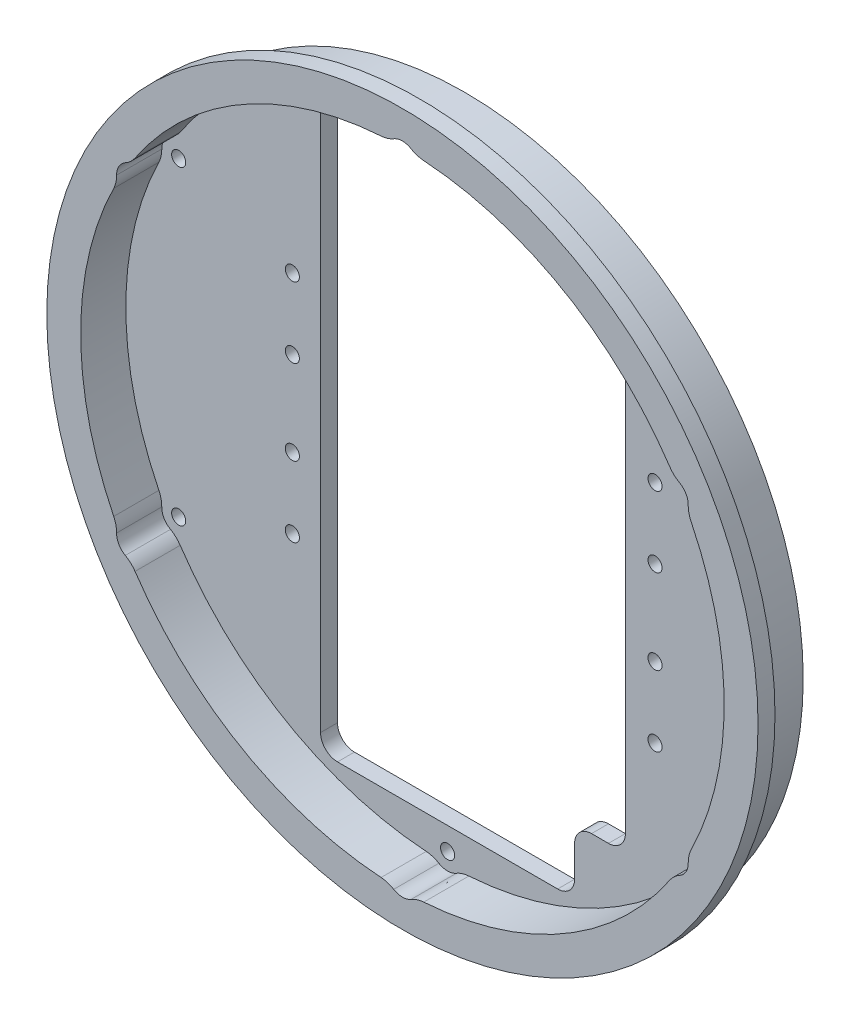
from build123d import *

# Parameters (mm, degrees)
SKETCH_1_R          = 60
EXTRUDE_1_DEPTH     = 3
SKETCH_2_R          = 60
SKETCH_2_R_2        = 57
EXTRUDE_2_DEPTH     = 8
EXTRUDE_START       = -3
SKETCH_3_R          = 63
SKETCH_3_R_2        = 60
EXTRUDE_3_DEPTH     = 3
CUT_EXTRUDE_1_REACH = 91.454
SKETCH_4_W          = 45
SKETCH_4_H          = 102
CUT_EXTRUDE_2_REACH = 91.454
SKETCH_5_W          = 9
SKETCH_5_H          = 79
FILLET_3_R          = 3
CUT_EXTRUDE_3_REACH = 91.454
SKETCH_6_R          = 1.25
CUT_EXTRUDE_4_REACH = 91.772
SKETCH_7_R          = 1.25
SKETCH_8_R          = 3
CUT_EXTRUDE_5_DEPTH = 8
FILLET_4_R          = 5


with BuildPart() as part:
    # 草图1 → 凸台-拉伸1 (new body)
    with BuildSketch(Plane.XY):
        Circle(SKETCH_1_R)
    extrude(amount=EXTRUDE_1_DEPTH)

    # 草图2 → 凸台-拉伸2 (add)
    with BuildSketch(Plane.XY.offset(3)):
        Circle(SKETCH_2_R)
        Circle(SKETCH_2_R_2, mode=Mode.SUBTRACT)
    extrude(amount=EXTRUDE_2_DEPTH)

    # 草图3 → 凸台-拉伸3 (add)
    with BuildSketch(Plane.XY.offset(11).offset(EXTRUDE_START)):
        Circle(SKETCH_3_R)
        Circle(SKETCH_3_R_2, mode=Mode.SUBTRACT)
    extrude(amount=EXTRUDE_3_DEPTH)

    # 草图4 → 切除-拉伸1 (cut, up to next)
    with BuildSketch(Plane.XY.offset(3), mode=Mode.PRIVATE) as cut_extrude_1_sk1:
        Rectangle(SKETCH_4_W, SKETCH_4_H)
    cut_extrude_1_tool1 = extrude(cut_extrude_1_sk1.sketch, amount=-CUT_EXTRUDE_1_REACH, mode=Mode.PRIVATE) & part.part
    add(cut_extrude_1_tool1.solids().sort_by_distance((0, 0, 3))[0], mode=Mode.SUBTRACT)

    # 草图5 → 切除-拉伸2 (cut, up to next)
    with BuildSketch(Plane.XY.offset(3), mode=Mode.PRIVATE) as cut_extrude_2_sk1:
        with Locations((27, 0)):
            Rectangle(SKETCH_5_W, SKETCH_5_H)
    cut_extrude_2_tool1 = extrude(cut_extrude_2_sk1.sketch, amount=-CUT_EXTRUDE_2_REACH, mode=Mode.PRIVATE) & part.part
    add(cut_extrude_2_tool1.solids().sort_by_distance((27, 0, 3))[0], mode=Mode.SUBTRACT)

    # 圆角3
    fillet_3_edges = [part.edges().sort_by_distance(p)[0] for p in [
        (22.5, 51, 1.5),
        (22.5, -51, 1.5),
        (-22.5, -51, 1.5),
        (-22.5, 51, 1.5),
        (22.5, -39.5, 1.5),
        (22.5, 39.5, 1.5),
        (31.5, 39.5, 1.5),
        (31.5, -39.5, 1.5),
    ]]
    fillet(fillet_3_edges, radius=FILLET_3_R)

    # 草图6 → 切除-拉伸3 (cut, up to next)
    with BuildSketch(Plane.XY.offset(3), mode=Mode.PRIVATE) as cut_extrude_3_sk1:
        with Locations((-27.5, 7.5)):
            Circle(SKETCH_6_R)
    cut_extrude_3_tool1 = extrude(cut_extrude_3_sk1.sketch, amount=-CUT_EXTRUDE_3_REACH, mode=Mode.PRIVATE) & part.part
    # 草图6 → 切除-拉伸3 (cut, up to next)
    with BuildSketch(Plane.XY.offset(3), mode=Mode.PRIVATE) as cut_extrude_3_sk2:
        with Locations((-27.5, 20)):
            Circle(SKETCH_6_R)
    cut_extrude_3_tool2 = extrude(cut_extrude_3_sk2.sketch, amount=-CUT_EXTRUDE_3_REACH, mode=Mode.PRIVATE) & part.part
    # 草图6 → 切除-拉伸3 (cut, up to next)
    with BuildSketch(Plane.XY.offset(3), mode=Mode.PRIVATE) as cut_extrude_3_sk3:
        with Locations((36.75, 7.5)):
            Circle(SKETCH_6_R)
    cut_extrude_3_tool3 = extrude(cut_extrude_3_sk3.sketch, amount=-CUT_EXTRUDE_3_REACH, mode=Mode.PRIVATE) & part.part
    # 草图6 → 切除-拉伸3 (cut, up to next)
    with BuildSketch(Plane.XY.offset(3), mode=Mode.PRIVATE) as cut_extrude_3_sk4:
        with Locations((36.75, 20)):
            Circle(SKETCH_6_R)
    cut_extrude_3_tool4 = extrude(cut_extrude_3_sk4.sketch, amount=-CUT_EXTRUDE_3_REACH, mode=Mode.PRIVATE) & part.part
    # 草图6 → 切除-拉伸3 (cut, up to next)
    with BuildSketch(Plane.XY.offset(3), mode=Mode.PRIVATE) as cut_extrude_3_sk5:
        with Locations((36.75, -7.5)):
            Circle(SKETCH_6_R)
    cut_extrude_3_tool5 = extrude(cut_extrude_3_sk5.sketch, amount=-CUT_EXTRUDE_3_REACH, mode=Mode.PRIVATE) & part.part
    # 草图6 → 切除-拉伸3 (cut, up to next)
    with BuildSketch(Plane.XY.offset(3), mode=Mode.PRIVATE) as cut_extrude_3_sk6:
        with Locations((-27.5, -7.5)):
            Circle(SKETCH_6_R)
    cut_extrude_3_tool6 = extrude(cut_extrude_3_sk6.sketch, amount=-CUT_EXTRUDE_3_REACH, mode=Mode.PRIVATE) & part.part
    # 草图6 → 切除-拉伸3 (cut, up to next)
    with BuildSketch(Plane.XY.offset(3), mode=Mode.PRIVATE) as cut_extrude_3_sk7:
        with Locations((-27.5, -20)):
            Circle(SKETCH_6_R)
    cut_extrude_3_tool7 = extrude(cut_extrude_3_sk7.sketch, amount=-CUT_EXTRUDE_3_REACH, mode=Mode.PRIVATE) & part.part
    # 草图6 → 切除-拉伸3 (cut, up to next)
    with BuildSketch(Plane.XY.offset(3), mode=Mode.PRIVATE) as cut_extrude_3_sk8:
        with Locations((36.75, -20)):
            Circle(SKETCH_6_R)
    cut_extrude_3_tool8 = extrude(cut_extrude_3_sk8.sketch, amount=-CUT_EXTRUDE_3_REACH, mode=Mode.PRIVATE) & part.part
    add(cut_extrude_3_tool1.solids().sort_by_distance((-27.5, 7.5, 3))[0], mode=Mode.SUBTRACT)
    add(cut_extrude_3_tool2.solids().sort_by_distance((-27.5, 20, 3))[0], mode=Mode.SUBTRACT)
    add(cut_extrude_3_tool3.solids().sort_by_distance((36.75, 7.5, 3))[0], mode=Mode.SUBTRACT)
    add(cut_extrude_3_tool4.solids().sort_by_distance((36.75, 20, 3))[0], mode=Mode.SUBTRACT)
    add(cut_extrude_3_tool5.solids().sort_by_distance((36.75, -7.5, 3))[0], mode=Mode.SUBTRACT)
    add(cut_extrude_3_tool6.solids().sort_by_distance((-27.5, -7.5, 3))[0], mode=Mode.SUBTRACT)
    add(cut_extrude_3_tool7.solids().sort_by_distance((-27.5, -20, 3))[0], mode=Mode.SUBTRACT)
    add(cut_extrude_3_tool8.solids().sort_by_distance((36.75, -20, 3))[0], mode=Mode.SUBTRACT)

    # 草图7 → 切除-拉伸4 (cut, up to next)
    with BuildSketch(Plane(origin=(0, 0, 0), x_dir=(-1, 0, 0), z_dir=(0, 0, -1)), mode=Mode.PRIVATE) as cut_extrude_4_sk1:
        with Locations((0, 55)):
            Circle(SKETCH_7_R)
    cut_extrude_4_tool1 = extrude(cut_extrude_4_sk1.sketch, amount=-CUT_EXTRUDE_4_REACH, mode=Mode.PRIVATE) & part.part
    # 草图7 → 切除-拉伸4 (cut, up to next)
    with BuildSketch(Plane(origin=(0, 0, 0), x_dir=(-1, 0, 0), z_dir=(0, 0, -1)), mode=Mode.PRIVATE) as cut_extrude_4_sk2:
        with Locations((47.631397208, 27.5)):
            Circle(SKETCH_7_R)
    cut_extrude_4_tool2 = extrude(cut_extrude_4_sk2.sketch, amount=-CUT_EXTRUDE_4_REACH, mode=Mode.PRIVATE) & part.part
    # 草图7 → 切除-拉伸4 (cut, up to next)
    with BuildSketch(Plane(origin=(0, 0, 0), x_dir=(-1, 0, 0), z_dir=(0, 0, -1)), mode=Mode.PRIVATE) as cut_extrude_4_sk3:
        with Locations((47.631397208, -27.5)):
            Circle(SKETCH_7_R)
    cut_extrude_4_tool3 = extrude(cut_extrude_4_sk3.sketch, amount=-CUT_EXTRUDE_4_REACH, mode=Mode.PRIVATE) & part.part
    # 草图7 → 切除-拉伸4 (cut, up to next)
    with BuildSketch(Plane(origin=(0, 0, 0), x_dir=(-1, 0, 0), z_dir=(0, 0, -1)), mode=Mode.PRIVATE) as cut_extrude_4_sk4:
        with Locations((0, -55)):
            Circle(SKETCH_7_R)
    cut_extrude_4_tool4 = extrude(cut_extrude_4_sk4.sketch, amount=-CUT_EXTRUDE_4_REACH, mode=Mode.PRIVATE) & part.part
    # 草图7 → 切除-拉伸4 (cut, up to next)
    with BuildSketch(Plane(origin=(0, 0, 0), x_dir=(-1, 0, 0), z_dir=(0, 0, -1)), mode=Mode.PRIVATE) as cut_extrude_4_sk5:
        with Locations((-47.631397208, -27.5)):
            Circle(SKETCH_7_R)
    cut_extrude_4_tool5 = extrude(cut_extrude_4_sk5.sketch, amount=-CUT_EXTRUDE_4_REACH, mode=Mode.PRIVATE) & part.part
    # 草图7 → 切除-拉伸4 (cut, up to next)
    with BuildSketch(Plane(origin=(0, 0, 0), x_dir=(-1, 0, 0), z_dir=(0, 0, -1)), mode=Mode.PRIVATE) as cut_extrude_4_sk6:
        with Locations((-47.631397208, 27.5)):
            Circle(SKETCH_7_R)
    cut_extrude_4_tool6 = extrude(cut_extrude_4_sk6.sketch, amount=-CUT_EXTRUDE_4_REACH, mode=Mode.PRIVATE) & part.part
    add(cut_extrude_4_tool1.solids().sort_by_distance((0, 55, 0))[0], mode=Mode.SUBTRACT)
    add(cut_extrude_4_tool2.solids().sort_by_distance((-47.631397, 27.5, 0))[0], mode=Mode.SUBTRACT)
    add(cut_extrude_4_tool3.solids().sort_by_distance((-47.631397, -27.5, 0))[0], mode=Mode.SUBTRACT)
    add(cut_extrude_4_tool4.solids().sort_by_distance((0, -55, 0))[0], mode=Mode.SUBTRACT)
    add(cut_extrude_4_tool5.solids().sort_by_distance((47.631397, -27.5, 0))[0], mode=Mode.SUBTRACT)
    add(cut_extrude_4_tool6.solids().sort_by_distance((47.631397, 27.5, 0))[0], mode=Mode.SUBTRACT)

    # 草图8 → 切除-拉伸5 (cut)
    with BuildSketch(Plane.XY.offset(3)):
        with Locations((-47.631397208, 27.5)):
            Circle(SKETCH_8_R)
        with Locations((0, 55)):
            Circle(SKETCH_8_R)
        with Locations((47.631397208, 27.5)):
            Circle(SKETCH_8_R)
        with Locations((47.631397208, -27.5)):
            Circle(SKETCH_8_R)
        with Locations((0, -55)):
            Circle(SKETCH_8_R)
        with Locations((-47.631397208, -27.5)):
            Circle(SKETCH_8_R)
    extrude(amount=CUT_EXTRUDE_5_DEPTH, mode=Mode.SUBTRACT)

    # 圆角4
    fillet_4_edges = [part.edges().sort_by_distance(p)[0] for p in [
        (2.275906867, -56.954545455, 7),
        (-2.275906867, -56.954545455, 7),
        (50.462036658, -26.506279564, 7),
        (48.186129791, -30.448265891, 7),
        (48.186129791, 30.448265891, 7),
        (50.462036658, 26.506279564, 7),
        (-2.275906867, 56.954545455, 7),
        (2.275906867, 56.954545455, 7),
        (-50.462036658, 26.506279564, 7),
        (-48.186129791, 30.448265891, 7),
        (-48.186129791, -30.448265891, 7),
        (-50.462036658, -26.506279564, 7),
    ]]
    fillet(fillet_4_edges, radius=FILLET_4_R)


solid = part.part
